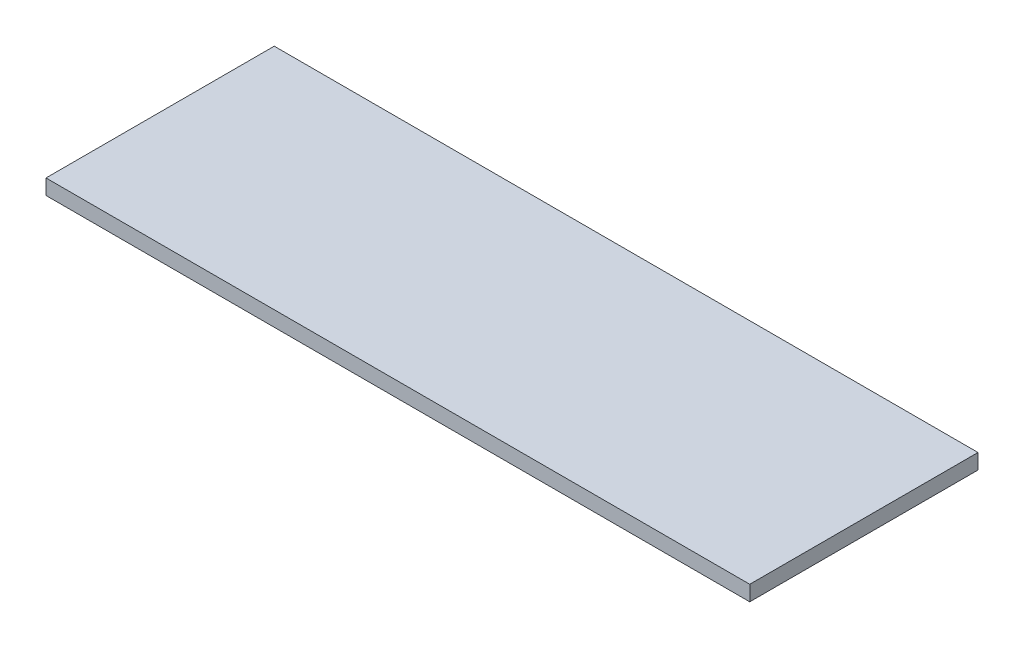
from build123d import *

# Parameters (mm, degrees)
SKETCH1_W           = 74
SKETCH1_H           = 24
BOSS_EXTRUDE1_DEPTH = 1.6


with BuildPart() as part:
    # Sketch1 → Boss-Extrude1 (new body)
    with BuildSketch(Plane(origin=(0, 0, 0), x_dir=(1, 0, 0), z_dir=(0, 1, 0))):
        with Locations((37, 12)):
            Rectangle(SKETCH1_W, SKETCH1_H)
    extrude(amount=BOSS_EXTRUDE1_DEPTH)


solid = part.part
